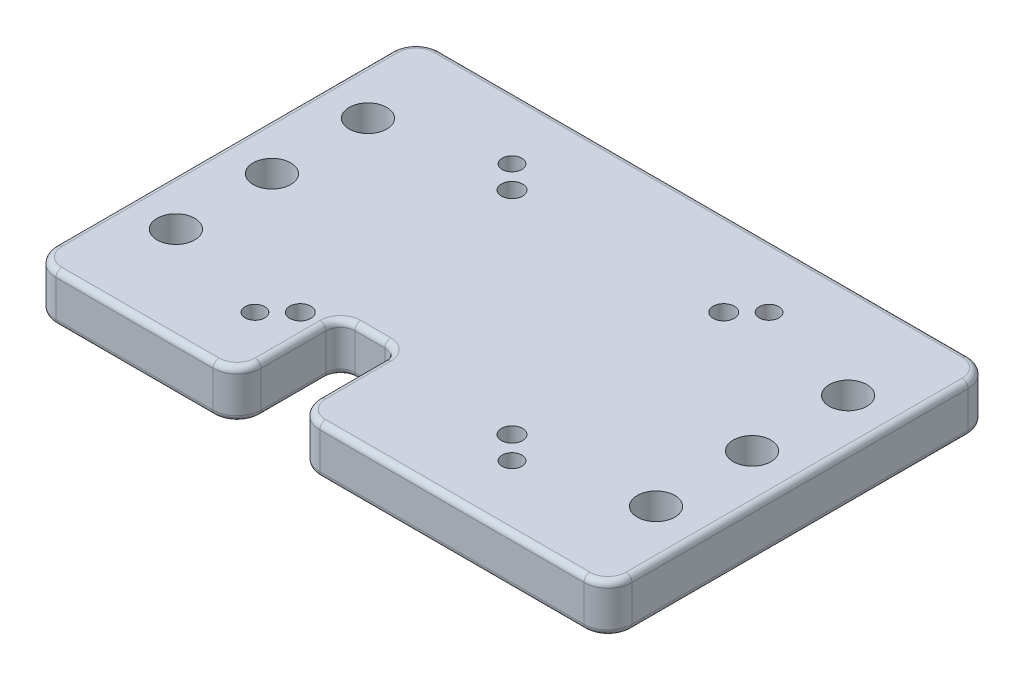
from build123d import *
from OCP.BRepFilletAPI import BRepFilletAPI_MakeFillet

# Parameters (mm, degrees)
SKETCH1_R           = 1.3
SKETCH1_R_2         = 1.4
SKETCH1_R_3         = 2.4892
BOSS_EXTRUDE1_DEPTH = 6.35
FILLET1_R1          = 3.175
FILLET1_R2          = 1.905
FILLET2_R           = 0.79375


with BuildPart() as part:
    # Sketch1 → Boss-Extrude1 (new body)
    with BuildSketch(Plane(origin=(0, 0, 0), x_dir=(1, 0, 0), z_dir=(0, 1, 0))):
        Polygon((-10.96, -25.4), (-10.96, -15.73), (-10.96, -11.72), (-3.2, -11.72), (-3.2, -15.73), (-3.2, -25.4), (38.1, -25.4), (38.1, 25.4), (-38.1, 25.4), (-38.1, -25.4), align=None)
        with Locations((-17, -17)):
            Circle(SKETCH1_R, mode=Mode.SUBTRACT)
        with Locations((-14, -14)):
            Circle(SKETCH1_R_2, mode=Mode.SUBTRACT)
        with Locations((-31.75, -12.7)):
            Circle(SKETCH1_R_3, mode=Mode.SUBTRACT)
        with Locations((-31.75, 0)):
            Circle(SKETCH1_R_3, mode=Mode.SUBTRACT)
        with Locations((17, -17)):
            Circle(SKETCH1_R, mode=Mode.SUBTRACT)
        with Locations((14, -14)):
            Circle(SKETCH1_R_2, mode=Mode.SUBTRACT)
        with Locations((31.75, -12.7)):
            Circle(SKETCH1_R_3, mode=Mode.SUBTRACT)
        with Locations((31.75, 0)):
            Circle(SKETCH1_R_3, mode=Mode.SUBTRACT)
        with Locations((-31.75, 12.7)):
            Circle(SKETCH1_R_3, mode=Mode.SUBTRACT)
        with Locations((-14, 14)):
            Circle(SKETCH1_R_2, mode=Mode.SUBTRACT)
        with Locations((-17, 17)):
            Circle(SKETCH1_R, mode=Mode.SUBTRACT)
        with Locations((31.75, 12.7)):
            Circle(SKETCH1_R_3, mode=Mode.SUBTRACT)
        with Locations((14, 14)):
            Circle(SKETCH1_R_2, mode=Mode.SUBTRACT)
        with Locations((17, 17)):
            Circle(SKETCH1_R, mode=Mode.SUBTRACT)
    extrude(amount=BOSS_EXTRUDE1_DEPTH)

    # Fillet1: one fillet with a radius per group of edges: ONE call of the kernel's fillet builder (fillet() takes one radius for all edges)
    fillet1_edges_1 = [part.edges().sort_by_distance(p)[0] for p in [
        (-38.1, 3.175, 25.4),
        (38.1, 3.175, 25.4),
        (38.1, 3.175, -25.4),
        (-38.1, 3.175, -25.4),
        (-10.96, 3.175, 25.4),
        (-3.2, 3.175, 25.4),
    ]]
    fillet1_edges_2 = [part.edges().sort_by_distance(p)[0] for p in [
        (-10.96, 3.175, 11.72),
        (-3.2, 3.175, 11.72),
    ]]
    fillet1 = BRepFilletAPI_MakeFillet(part.part.solid().wrapped)
    for e in fillet1_edges_1:
        fillet1.Add(FILLET1_R1, e.wrapped)
    for e in fillet1_edges_2:
        fillet1.Add(FILLET1_R2, e.wrapped)
    add(Compound.cast(fillet1.Shape()), mode=Mode.REPLACE)

    # Fillet2
    fillet2_edges = [part.edges().sort_by_distance(p)[0] for p in [
        (-37.17006403, 0, -24.47006403),
        (-38.1, 0, 0),
        (-37.17006403, 0, 24.47006403),
        (-24.53, 0, 25.4),
        (-11.88993597, 0, 24.47006403),
        (-10.96, 0, 17.925),
        (-10.402038418, 0, 12.277961582),
        (-7.08, 0, 11.72),
        (-3.757961582, 0, 12.277961582),
        (-3.2, 0, 17.925),
        (-2.27006403, 0, 24.47006403),
        (17.45, 0, 25.4),
        (37.17006403, 0, 24.47006403),
        (38.1, 0, 0),
        (37.17006403, 0, -24.47006403),
        (-3.757961582, 6.35, 12.277961582),
        (-7.08, 6.35, 11.72),
        (-10.402038418, 6.35, 12.277961582),
        (-10.96, 6.35, 17.925),
        (-11.88993597, 6.35, 24.47006403),
        (-24.53, 6.35, 25.4),
        (-37.17006403, 6.35, 24.47006403),
        (-38.1, 6.35, 0),
        (-37.17006403, 6.35, -24.47006403),
        (0, 6.35, -25.4),
        (37.17006403, 6.35, -24.47006403),
        (38.1, 6.35, 0),
        (37.17006403, 6.35, 24.47006403),
        (17.45, 6.35, 25.4),
        (-2.27006403, 6.35, 24.47006403),
        (-3.2, 6.35, 17.925),
        (0, 0, -25.4),
    ]]
    fillet(fillet2_edges, radius=FILLET2_R)


solid = part.part
